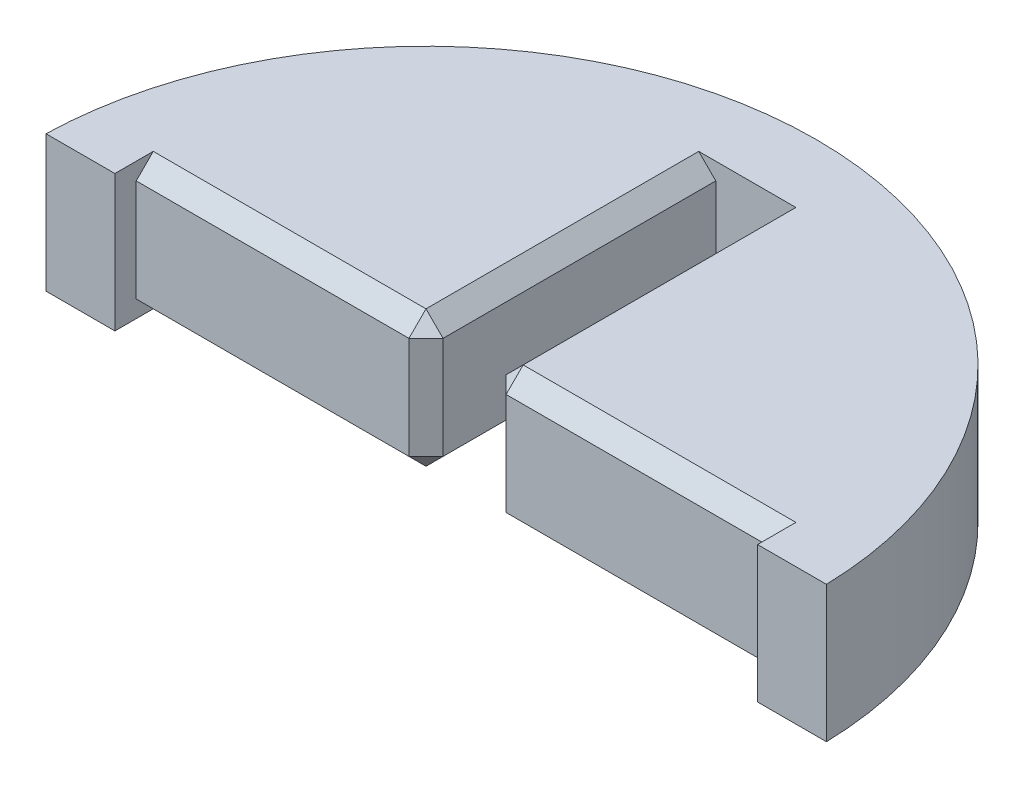
from build123d import *

# Parameters (mm, degrees)
BOSS_EXTRUDE1_DEPTH      = 3
BOSS_EXTRUDE1_DEPTH_BACK = 1
CHAMFER1_SIZE            = 0.5


with BuildPart() as part:
    # Sketch2 → Boss-Extrude1 (new, two sides: drawn at the far end of the back side and taken through both)
    with BuildSketch(Plane(origin=(0, 0, 0), x_dir=(1, 0, 0), z_dir=(0, 1, 0)).offset(-BOSS_EXTRUDE1_DEPTH_BACK)):
        with BuildLine():
            Line((-9.425, 0.3), (-9.425, 0.925))
            Line((-9.425, 0.925), (-0.925, 0.925))
            Line((-0.925, 0.925), (-0.925, 9.425))
            Line((-0.925, 9.425), (0, 9.425))
            Line((0, 9.425), (0.925, 9.425))
            Line((0.925, 9.425), (0.925, 0.925))
            Line((0.925, 0.925), (9.425, 0.925))
            Line((9.425, 0.925), (9.425, 0.3))
            Line((9.425, 0.3), (11.446169588, 0.3))
            ThreePointArc((11.446169588, 0.3), (0, 11.45010036), (-11.446169588, 0.3))
            Line((-11.446169588, 0.3), (-9.425, 0.3))
        make_face()
    extrude(amount=BOSS_EXTRUDE1_DEPTH + BOSS_EXTRUDE1_DEPTH_BACK)

    # Chamfer1
    chamfer1_edges = [part.edges().sort_by_distance(p)[0] for p in [
        (-5.175, -1, -0.925),
        (-0.925, -1, -5.175),
        (0.925, 1, -0.925),
        (-0.925, 1, -0.925),
        (0.925, -1, -5.175),
        (-5.175, 3, -0.925),
        (-0.925, 3, -5.175),
        (0.925, 3, -5.175),
        (5.175, 3, -0.925),
        (5.175, -1, -0.925),
    ]]
    chamfer(chamfer1_edges, length=CHAMFER1_SIZE)


solid = part.part
